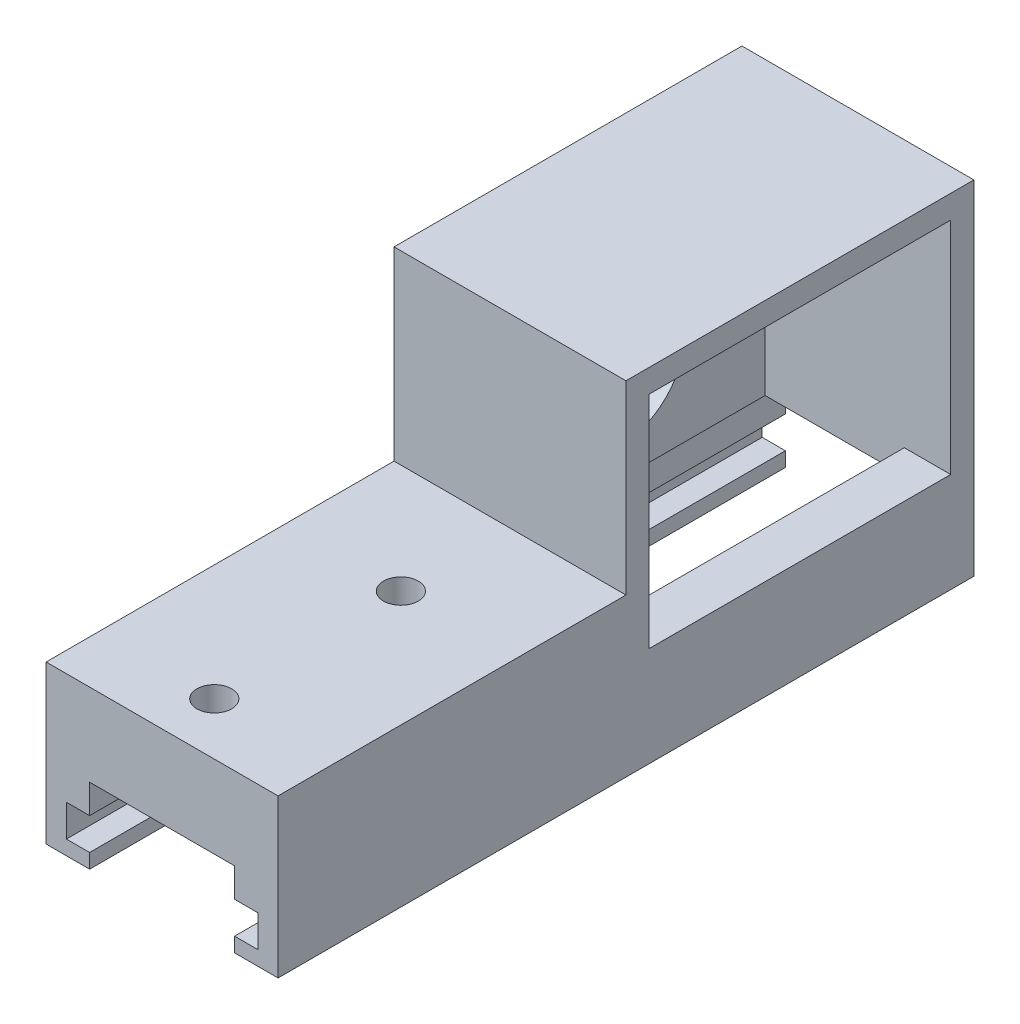
from build123d import *

# Parameters (mm, degrees)
SKETCH1_W           = 20
SKETCH1_H           = 13.6
BOSS_EXTRUDE1_DEPTH = 65
SKETCH3_R           = 1.5
CUT_EXTRUDE2_DEPTH  = 68.298918099
SKETCH5_W           = 35
SKETCH5_H           = 5
CUT_EXTRUDE4_DEPTH  = 69.519668815
SKETCH6_W           = 12
SKETCH6_H           = 31
CUT_EXTRUDE5_DEPTH  = 5
SKETCH7_W           = 20
SKETCH7_H           = 35
BOSS_EXTRUDE2_DEPTH = 21
SKETCH8_W           = 31
SKETCH8_H           = 19
CUT_EXTRUDE6_DEPTH  = 16
CUT_EXTRUDE7_DEPTH  = 71.228177029
SKETCH11_W          = 5
SKETCH11_H          = 29.6
CUT_EXTRUDE8_DEPTH  = 72.246030408
BOSS_EXTRUDE3_REACH = 68.716
SKETCH12_W          = 2
SKETCH12_H          = 29.6
CUT_EXTRUDE9_DEPTH  = 65.576940359
CUT_EXTRUDE10_DEPTH = 4


with BuildPart() as part:
    # Sketch1 → Boss-Extrude1 (new body)
    with BuildSketch(Plane.XY):
        with Locations((0.917159763, -1.563313609)):
            Rectangle(SKETCH1_W, SKETCH1_H)
    extrude(amount=-BOSS_EXTRUDE1_DEPTH)

    # Sketch3 → Cut-Extrude2 (cut, through all)
    with BuildSketch(Plane(origin=(0, 5.236686391, 0), x_dir=(1, 0, 0), z_dir=(0, 1, 0))):
        with Locations(Location((0.917159763, 4.5, 0), (0, 0, 270))):
            Circle(SKETCH3_R)
        with Locations(Location((0.917159763, 20.589405581, 0), (0, 0, 270))):
            Circle(SKETCH3_R)
    extrude(amount=-CUT_EXTRUDE2_DEPTH, mode=Mode.SUBTRACT)

    # Sketch5 → Cut-Extrude4 (cut, through all)
    with BuildSketch(Plane(origin=(10.917159763, 0, 0), x_dir=(0, 0, -1), z_dir=(1, 0, 0))):
        with Locations((47.5, 2.736686391)):
            Rectangle(SKETCH5_W, SKETCH5_H)
    extrude(amount=-CUT_EXTRUDE4_DEPTH, mode=Mode.SUBTRACT)

    # Sketch6 → Cut-Extrude5 (cut)
    with BuildSketch(Plane(origin=(0, 0.236686391, 0), x_dir=(1, 0, 0), z_dir=(0, 1, 0))):
        with Locations((0.917159763, 47.5)):
            Rectangle(SKETCH6_W, SKETCH6_H)
    extrude(amount=-CUT_EXTRUDE5_DEPTH, mode=Mode.SUBTRACT)

    # Sketch7 → Boss-Extrude2 (add)
    with BuildSketch(Plane(origin=(0, 0.236686391, 0), x_dir=(1, 0, 0), z_dir=(0, 1, 0))):
        with Locations((0.917159763, 47.5)):
            Rectangle(SKETCH7_W, SKETCH7_H)
    extrude(amount=BOSS_EXTRUDE2_DEPTH)

    # Sketch8 → Cut-Extrude6 (cut)
    with BuildSketch(Plane(origin=(10.917159763, 0, 0), x_dir=(0, 0, -1), z_dir=(1, 0, 0))):
        with Locations((47.5, 9.736686391)):
            Rectangle(SKETCH8_W, SKETCH8_H)
    extrude(amount=-CUT_EXTRUDE6_DEPTH, mode=Mode.SUBTRACT)

    # Sketch9 → Cut-Extrude7 (cut, through all)
    with BuildSketch(Plane(origin=(-5.082840237, 0, 0), x_dir=(0, 0, -1), z_dir=(1, 0, 0))):
        with BuildLine():
            Line((37.385714286, 8.585806938), (43.1, 11.296330647))
            ThreePointArc((43.1, 11.296330647), (51.1, 6.236686391), (43.1, 1.177042134))
            Line((43.1, 1.177042134), (37.385714286, 3.887565843))
            ThreePointArc((37.385714286, 3.887565843), (35.9, 6.236686391), (37.385714286, 8.585806938))
        make_face()
    extrude(amount=-CUT_EXTRUDE7_DEPTH, mode=Mode.SUBTRACT)

    # Sketch11 → Cut-Extrude8 (cut, through all)
    with BuildSketch(Plane(origin=(10.917159763, 0, 0), x_dir=(0, 0, -1), z_dir=(1, 0, 0))):
        with Locations((62.5, 6.436686391)):
            Rectangle(SKETCH11_W, SKETCH11_H)
    extrude(amount=-CUT_EXTRUDE8_DEPTH, mode=Mode.SUBTRACT)

    # Boss-Extrude3: up to this face of the body (flat: up to its plane)
    boss_extrude3_end = Plane(part.part.faces().sort_by_distance((-9.082840237, 3.675844839, -34.656950913))[0])
    # Sketch12 → Boss-Extrude3 (add, up to the picked face)
    with BuildSketch(Plane(origin=(10.917159763, 0, 0), x_dir=(0, 0, -1), z_dir=(1, 0, 0)), mode=Mode.PRIVATE) as boss_extrude3_sk1:
        with Locations((59, 6.436686391)):
            Rectangle(SKETCH12_W, SKETCH12_H)
    boss_extrude3_tool1 = split(extrude(boss_extrude3_sk1.sketch, amount=-BOSS_EXTRUDE3_REACH, mode=Mode.PRIVATE), bisect_by=boss_extrude3_end, keep=Keep.BOTH, mode=Mode.PRIVATE)
    add(boss_extrude3_tool1.solids().sort_by(Axis((10.91716, 6.436686, -59), (-1, 0, 0)))[0])

    # Sketch2 → Cut-Extrude9 (cut, through all)
    with BuildSketch(Plane.XY):
        Polygon((-5.332840237, -8.363313609), (-5.332840237, -7.113313609), (-7.332840237, -7.113313609), (-7.332840237, -4.363313609), (-5.332840237, -4.363313609), (-5.332840237, -1.863313609), (7.167159763, -1.863313609), (7.167159763, -4.363313609), (9.167159763, -4.363313609), (9.167159763, -7.113313609), (7.167159763, -7.113313609), (7.167159763, -8.363313609), align=None)
    extrude(amount=-CUT_EXTRUDE9_DEPTH, mode=Mode.SUBTRACT)

    # Sketch13 → Cut-Extrude10 (cut)
    with BuildSketch(Plane.XZ.offset(1.863313609)):
        Polygon((2.507159763, -7.253960784), (4.097159763, -4.5), (2.507159763, -1.746039216), (-0.672840237, -1.746039216), (-2.262840237, -4.5), (-0.672840237, -7.253960784), align=None)
        Polygon((2.507159763, -23.343366365), (4.097159763, -20.589405581), (2.507159763, -17.835444797), (-0.672840237, -17.835444797), (-2.262840237, -20.589405581), (-0.672840237, -23.343366365), align=None)
    extrude(amount=-CUT_EXTRUDE10_DEPTH, mode=Mode.SUBTRACT)


solid = part.part
